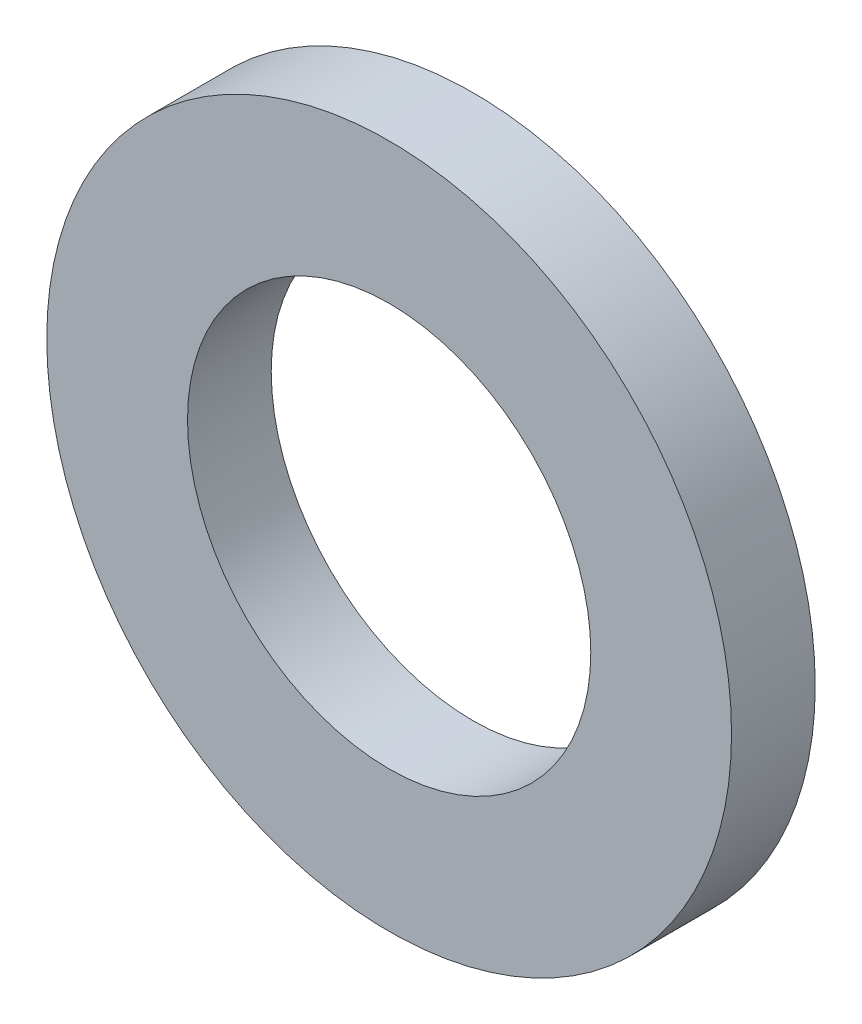
from build123d import *

# Parameters (mm, degrees)
SKETCH1_R           = 4.5
SKETCH1_R_2         = 2.65
BOSS_EXTRUDE1_DEPTH = 1.1


with BuildPart() as part:
    # Sketch1 → Boss-Extrude1 (new body)
    with BuildSketch(Plane.XY):
        with Locations(Location((0, 0, 0), (0, 0, 180))):
            Circle(SKETCH1_R)
        with Locations(Location((0, 0, 0), (0, 0, 180))):
            Circle(SKETCH1_R_2, mode=Mode.SUBTRACT)
    extrude(amount=BOSS_EXTRUDE1_DEPTH)


solid = part.part
